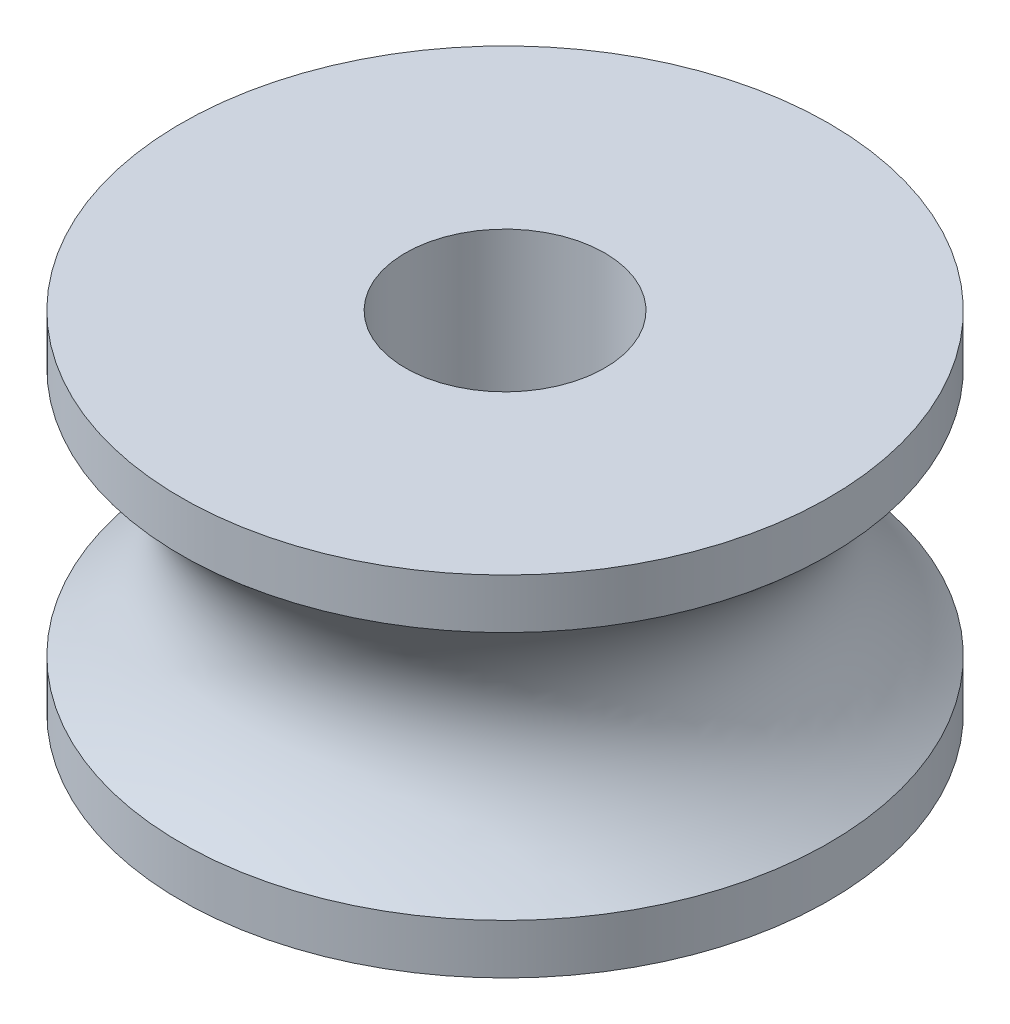
from build123d import *

# Parameters (mm, degrees)
SKETCH_2_R          = 2
CUT_EXTRUDE_1_DEPTH = 10


with BuildPart() as part:
    # ｽｹｯﾁ1 → 回転1 (revolve)
    with BuildSketch(Plane.XY, mode=Mode.PRIVATE) as revolve_1_sk:
        with BuildLine():
            add(Edge.make_bspline(
                [(6.5, 6), (3.5, 3.5), (6.5, 1)],
                knots=[0, 0, 0, 1, 1, 1], degree=2))
            Line((6.5, 1), (6.5, 0))
            Line((6.5, 0), (0, 0))
            Line((0, 0), (0, 7))
            Line((0, 7), (6.5, 7))
            Line((6.5, 7), (6.5, 6))
        make_face()
    revolve(revolve_1_sk.sketch.rotate(Axis((0, 0, 0), (0, 1, 0)), 90), axis=Axis((0, 0, 0), (0, 1, 0)))

    # ｽｹｯﾁ2 → ｶｯﾄ - 押し出し1 (cut)
    with BuildSketch(Plane.XZ):
        with Locations(Location((0, 0, 0), (0, 0, 270))):
            Circle(SKETCH_2_R)
    extrude(amount=-CUT_EXTRUDE_1_DEPTH, mode=Mode.SUBTRACT)


solid = part.part
